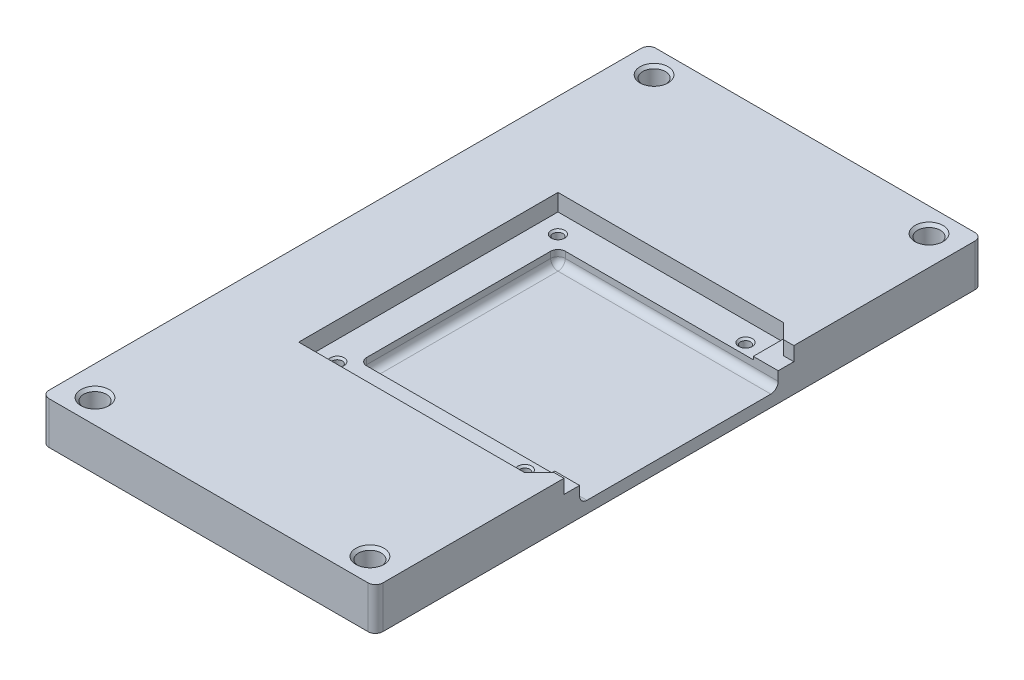
from build123d import *

# Parameters (mm, degrees)
BOSS_EXTRUDE1_DEPTH     = 11.5
SKETCH4_R               = 3.075
CUT_EXTRUDE1_DEPTH      = 6
CUT_EXTRUDE6_DEPTH      = 4.6
CUT_EXTRUDE3_DEPTH      = 95.407365311
CUT_EXTRUDE3_DEPTH_BACK = 3.7
SKETCH24_W              = 59.875
SKETCH24_H              = 54
SKETCH25_R              = 1.35
CUT_EXTRUDE4_DEPTH      = 5
CHAMFER4_SIZE           = 0.5
FILLET1_R               = 2
BOSS_EXTRUDE2_DEPTH     = 0.8
CHAMFER5_SIZE           = 0.75


with BuildPart() as part:
    # Sketch1 → Boss-Extrude1 (new body)
    with BuildSketch(Plane(origin=(0, 0, 0), x_dir=(1, 0, 0), z_dir=(0, 1, 0))):
        with BuildLine():
            Line((-45.375, 67.5), (-45.375, -67.5))
            Line((-45.375, -67.5), (-45.375, -80.5))
            ThreePointArc((-45.375, -80.5), (-44.789213562, -81.914213562), (-43.375, -82.5))
            Line((-43.375, -82.5), (43.375, -82.5))
            ThreePointArc((43.375, -82.5), (44.789213562, -81.914213562), (45.375, -80.5))
            Line((45.375, -80.5), (45.375, -67.5))
            Line((45.375, -67.5), (45.375, 67.5))
            Line((45.375, 67.5), (45.375, 80.5))
            ThreePointArc((45.375, 80.5), (44.789213562, 81.914213562), (43.375, 82.5))
            Line((43.375, 82.5), (-43.375, 82.5))
            ThreePointArc((-43.375, 82.5), (-44.789213562, 81.914213562), (-45.375, 80.5))
            Line((-45.375, 80.5), (-45.375, 67.5))
        make_face()
    extrude(amount=BOSS_EXTRUDE1_DEPTH)

    # Sketch4 → Cut-Extrude1 (cut)
    with BuildSketch(Plane(origin=(0, 11.5, 0), x_dir=(1, 0, 0), z_dir=(0, 1, 0))):
        with Locations(Location((-37.375, -76, 0), (0, 0, 270))):
            Circle(SKETCH4_R)
        with Locations(Location((37.375, -76, 0), (0, 0, 270))):
            Circle(SKETCH4_R)
        with Locations(Location((37.375, 76, 0), (0, 0, 270))):
            Circle(SKETCH4_R)
        with Locations(Location((-37.375, 76, 0), (0, 0, 270))):
            Circle(SKETCH4_R)
    extrude(amount=-CUT_EXTRUDE1_DEPTH, mode=Mode.SUBTRACT)

    # Sketch21 → Cut-Extrude6 (cut)
    with BuildSketch(Plane(origin=(0, 11.5, 0), x_dir=(1, 0, 0), z_dir=(0, 1, 0))):
        Polygon((45.375, 31), (45.375, -31), (45.375, -31.25), (42.603553391, -31.25), (38.603553391, -35.25), (-22.75, -35.25), (-22.75, 35.25), (38.603553391, 35.25), (42.603553391, 31.25), (45.375, 31.25), align=None)
    extrude(amount=-CUT_EXTRUDE6_DEPTH, mode=Mode.SUBTRACT)

    # Sketch24 → Cut-Extrude3 (cut, two sides: drawn at the far end of the back side and taken through both)
    with BuildSketch(Plane(origin=(0, 6.9, 0), x_dir=(1, 0, 0), z_dir=(0, 1, 0)).offset(-CUT_EXTRUDE3_DEPTH_BACK)):
        with Locations((15.4375, 0)):
            Rectangle(SKETCH24_W, SKETCH24_H)
    extrude(amount=CUT_EXTRUDE3_DEPTH + CUT_EXTRUDE3_DEPTH_BACK, mode=Mode.SUBTRACT)

    # Sketch25 → Cut-Extrude4 (cut)
    with BuildSketch(Plane(origin=(0, 6.9, 0), x_dir=(1, 0, 0), z_dir=(0, 1, 0))):
        with Locations(Location((33.5, 30, 0), (0, 0, 270))):
            Circle(SKETCH25_R)
        with Locations(Location((-17.5, 30, 0), (0, 0, 270))):
            Circle(SKETCH25_R)
        with Locations(Location((33.5, -30, 0), (0, 0, 270))):
            Circle(SKETCH25_R)
        with Locations(Location((-17.5, -30, 0), (0, 0, 270))):
            Circle(SKETCH25_R)
    extrude(amount=-CUT_EXTRUDE4_DEPTH, mode=Mode.SUBTRACT)

    # Chamfer4
    chamfer4_edges = [part.edges().sort_by_distance(p)[0] for p in [
        (-17.5, 6.9, -31.35),
        (33.5, 6.9, 28.65),
        (-17.5, 6.9, 28.65),
        (33.5, 6.9, -31.35),
    ]]
    chamfer(chamfer4_edges, length=CHAMFER4_SIZE)

    # Fillet1
    fillet1_edges = [part.edges().sort_by_distance(p)[0] for p in [
        (15.4375, 3.2, -27),
        (-14.5, 5.05, -27),
        (-14.5, 3.2, 0),
        (-14.5, 5.05, 27),
        (15.4375, 3.2, 27),
    ]]
    fillet(fillet1_edges, radius=FILLET1_R)

    # Sketch26 → Boss-Extrude2 (add)
    with BuildSketch(Plane(origin=(0, 6.9, 0), x_dir=(1, 0, 0), z_dir=(0, 1, 0))):
        Polygon((38.603553391, 35.25), (38.603553391, 27), (45.375, 27), (45.375, 31.25), (42.603553391, 31.25), align=None)
        Polygon((42.603553391, -31.25), (38.603553391, -35.25), (38.603553391, -27), (45.375, -27), (45.375, -31.25), align=None)
    extrude(amount=BOSS_EXTRUDE2_DEPTH)

    # Chamfer5
    chamfer5_edges = [part.edges().sort_by_distance(p)[0] for p in [
        (-37.375, 11.5, -79.075),
        (37.375, 11.5, -79.075),
        (37.375, 11.5, 72.925),
        (-37.375, 11.5, 72.925),
    ]]
    chamfer(chamfer5_edges, length=CHAMFER5_SIZE)


solid = part.part
